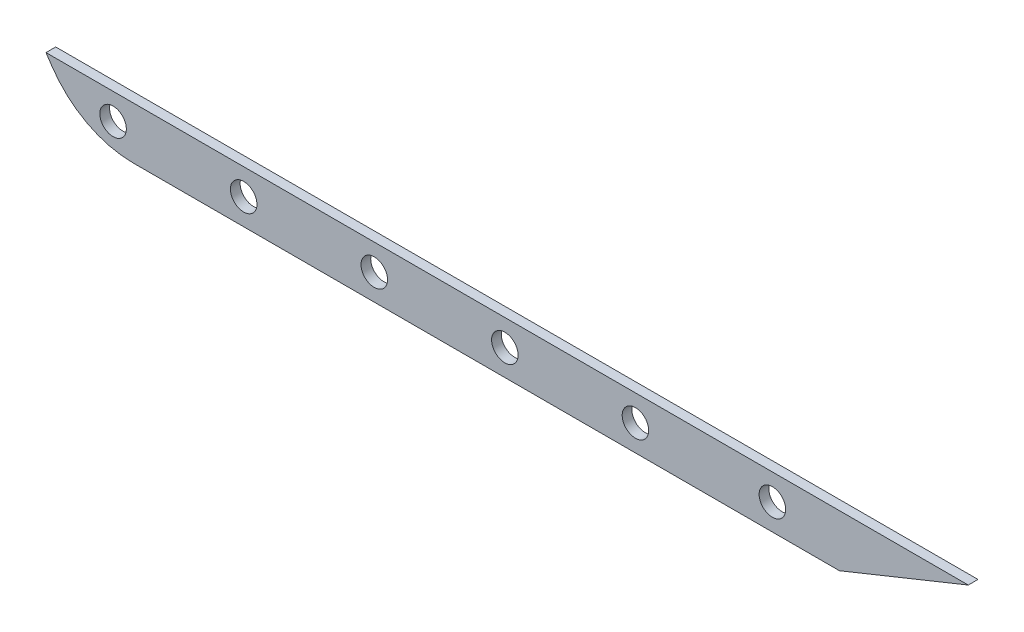
from build123d import *

# Parameters (mm, degrees)
BOSS_EXTRUDE1_DEPTH = 4.7625
SKETCH1_4_R         = 6.5
CUT_EXTRUDE1_DEPTH  = 439.920211962
CUT_EXTRUDE5_DEPTH  = 10
FILLET1_R           = 48
CUT_EXTRUDE6_DEPTH  = 10


with BuildPart() as part:
    # Sketch1 → Boss-Extrude1 (new body)
    with BuildSketch(Plane.XY):
        Polygon((428.120588235, 28.570833333), (0, 28.570833333), (-98.879411765, 3.850980392), (-31.879411765, -96.649019608), (366, -96.649019608), (403.120588235, -71.149019608), align=None)
    extrude(amount=BOSS_EXTRUDE1_DEPTH)

    # Sketch1<4> → Cut-Extrude1 (cut, through all)
    with BuildSketch(Plane.XY):
        with Locations((-16, -83.899019608)):
            Circle(SKETCH1_4_R)
        with Locations((48, -83.899019608)):
            Circle(SKETCH1_4_R)
        with Locations((112, -83.899019608)):
            Circle(SKETCH1_4_R)
        with Locations((176, -83.899019608)):
            Circle(SKETCH1_4_R)
        with Locations((240, -83.899019608)):
            Circle(SKETCH1_4_R)
        with Locations((307.120588235, -83.899019608)):
            Circle(SKETCH1_4_R)
    extrude(amount=CUT_EXTRUDE1_DEPTH, mode=Mode.SUBTRACT)

    # Sketch8 → Cut-Extrude5 (cut)
    with BuildSketch(Plane.XY.offset(4.7625)):
        Polygon((-48.879411765, -71.149019608), (403.120588235, -71.149019608), (428.120588235, 28.570833333), (0, 28.570833333), (-98.879411765, 3.850980392), align=None)
    extrude(amount=-CUT_EXTRUDE5_DEPTH, mode=Mode.SUBTRACT)

    # Fillet1
    fillet1_edges = [part.edges().sort_by_distance(p)[0] for p in [
        (-31.879411765, -96.649019608, 2.38125),
    ]]
    fillet(fillet1_edges, radius=FILLET1_R)

    # Sketch9 → Cut-Extrude6 (cut)
    with BuildSketch(Plane.XY.offset(4.7625)):
        Polygon((403.120588235, -71.149019608), (340.005873473, -96.649019608), (366, -96.649019608), align=None)
    extrude(amount=-CUT_EXTRUDE6_DEPTH, mode=Mode.SUBTRACT)


solid = part.part
